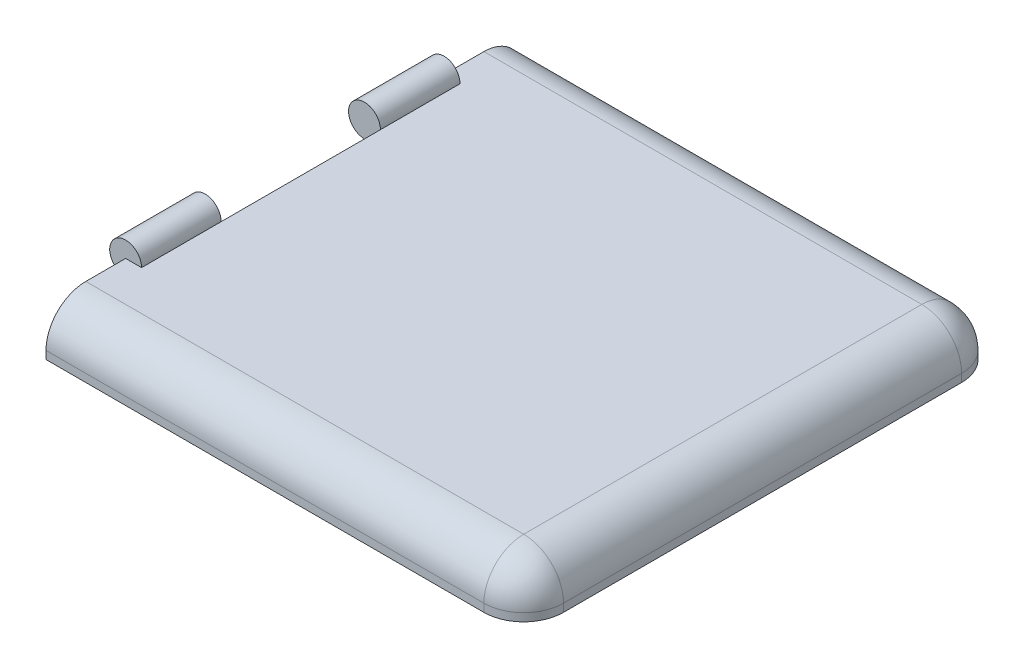
from build123d import *

# Parameters (mm, degrees)
SKETCH1_W                      = 600
SKETCH1_H                      = 600
BOSS_EXTRUDE1_DEPTH            = 60
BOSS_EXTRUDE2_START            = 100
SKETCH2_R                      = 20
BOSS_EXTRUDE2_DEPTH            = 100
BOSS_EXTRUDE3_START            = -200
SKETCH2_2_R                    = 20
BOSS_EXTRUDE3_DEPTH            = 100
CUT_EXTRUDE1_REACH             = 677.574
SKETCH2_3_R                    = 20
CUT_EXTRUDE1_DIRECTION_2_REACH = 677.574
FILLET1_R                      = 50


with BuildPart() as part:
    # Sketch1 → Boss-Extrude1 (new body)
    with BuildSketch(Plane(origin=(0, 0, 0), x_dir=(1, 0, 0), z_dir=(0, 1, 0))):
        with Locations((300, 300)):
            Rectangle(SKETCH1_W, SKETCH1_H)
    extrude(amount=BOSS_EXTRUDE1_DEPTH)

    # Sketch2 → Boss-Extrude2 (add)
    with BuildSketch(Plane.XY.offset(-300).offset(BOSS_EXTRUDE2_START)):
        with Locations((0, 60)):
            Circle(SKETCH2_R)
    extrude(amount=BOSS_EXTRUDE2_DEPTH)

    # Sketch2<2> → Boss-Extrude3 (add)
    with BuildSketch(Plane.XY.offset(-300).offset(BOSS_EXTRUDE3_START)):
        with Locations((0, 60)):
            Circle(SKETCH2_2_R)
    extrude(amount=BOSS_EXTRUDE3_DEPTH)

    # Cut-Extrude1: up to this face of the body (flat: up to its plane)
    cut_extrude1_end = Plane(part.part.faces().sort_by_distance((-2.829421211, 62.829421211, -400))[0])
    # Sketch2<3> → Cut-Extrude1 (cut, up to the picked face)
    with BuildSketch(Plane.XY.offset(-300), mode=Mode.PRIVATE) as cut_extrude1_sk1:
        with Locations((0, 60)):
            Circle(SKETCH2_3_R)
    cut_extrude1_tool1 = split(extrude(cut_extrude1_sk1.sketch, amount=-CUT_EXTRUDE1_REACH, mode=Mode.PRIVATE), bisect_by=cut_extrude1_end, keep=Keep.BOTH, mode=Mode.PRIVATE)
    add(cut_extrude1_tool1.solids().sort_by(Axis((0, 60, -300), (0, 0, -1)))[0], mode=Mode.SUBTRACT)

    # Cut-Extrude1 direction 2: up to this face of the body (flat: up to its plane)
    cut_extrude1_direction_2_end = Plane(part.part.faces().sort_by_distance((-2.829421211, 62.829421211, -200))[0])
    # Sketch2<3> → Cut-Extrude1 direction 2 (cut, up to the picked face)
    with BuildSketch(Plane.XY.offset(-300), mode=Mode.PRIVATE) as cut_extrude1_direction_2_sk1:
        with Locations((0, 60)):
            Circle(SKETCH2_3_R)
    cut_extrude1_direction_2_tool1 = split(extrude(cut_extrude1_direction_2_sk1.sketch, amount=CUT_EXTRUDE1_DIRECTION_2_REACH, mode=Mode.PRIVATE), bisect_by=cut_extrude1_direction_2_end, keep=Keep.BOTH, mode=Mode.PRIVATE)
    add(cut_extrude1_direction_2_tool1.solids().sort_by(Axis((0, 60, -300), (0, 0, 1)))[0], mode=Mode.SUBTRACT)

    # Fillet1
    fillet1_edges = [part.edges().sort_by_distance(p)[0] for p in [
        (300, 60, 0),
        (600, 60, -300),
        (300, 60, -600),
        (600, 30, -600),
        (600, 30, 0),
    ]]
    fillet(fillet1_edges, radius=FILLET1_R)


solid = part.part
